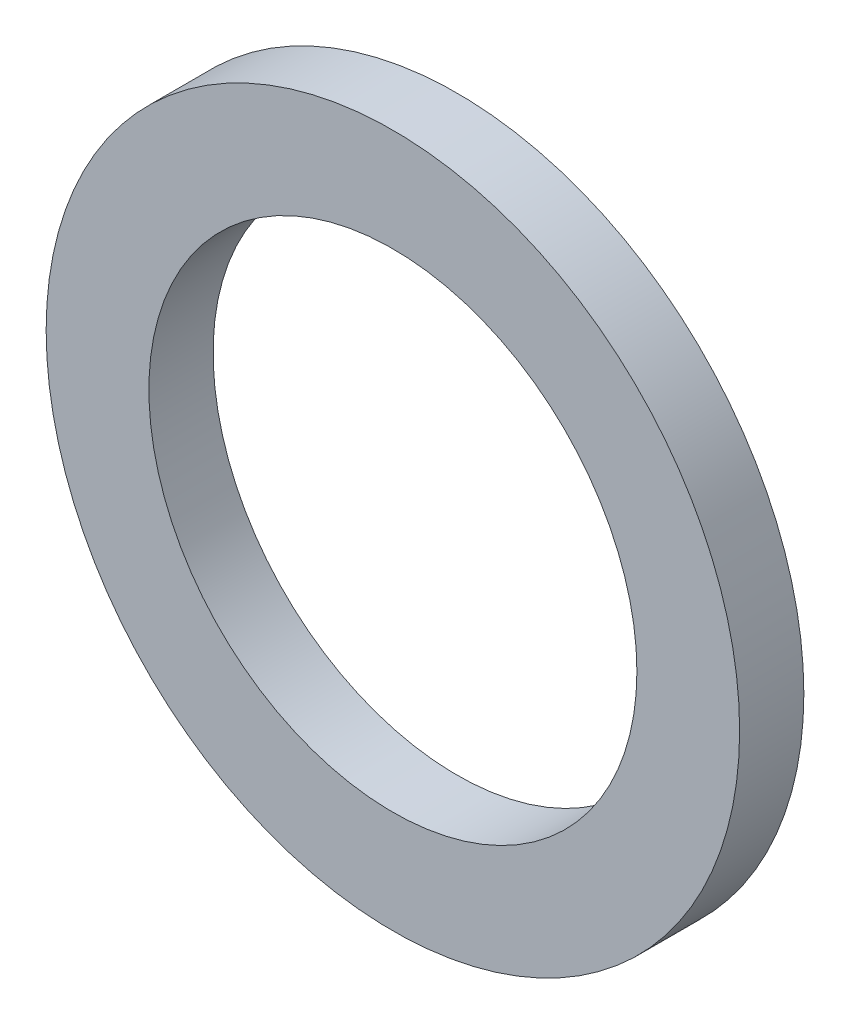
from build123d import *

# Parameters (mm, degrees)
SKETCH1_R           = 27
SKETCH1_R_2         = 19
BOSS_EXTRUDE1_DEPTH = 5


with BuildPart() as part:
    # Sketch1 → Boss-Extrude1 (new body)
    with BuildSketch(Plane.XY):
        Circle(SKETCH1_R)
        Circle(SKETCH1_R_2, mode=Mode.SUBTRACT)
    extrude(amount=BOSS_EXTRUDE1_DEPTH)


solid = part.part
